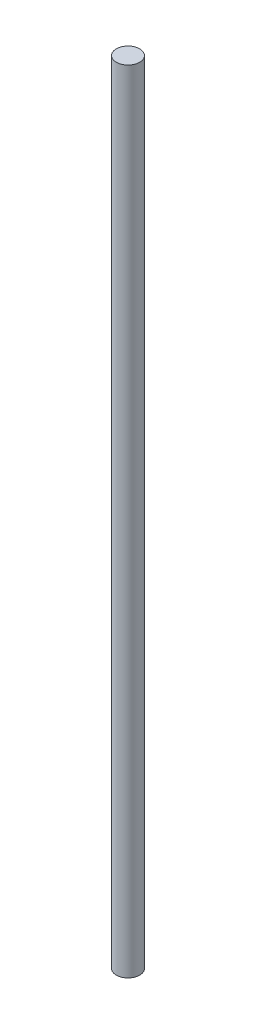
from build123d import *

# Parameters (mm, degrees)
CROQUIS1_R              = 1.55
SALIENTE_EXTRUIR1_DEPTH = 105


with BuildPart() as part:
    # Croquis1 → Saliente-Extruir1 (new body)
    with BuildSketch(Plane(origin=(0, 0, 0), x_dir=(1, 0, 0), z_dir=(0, 1, 0))):
        with Locations(Location((0, 0, 0), (0, 0, 270))):
            Circle(CROQUIS1_R)
    extrude(amount=SALIENTE_EXTRUIR1_DEPTH)


solid = part.part
